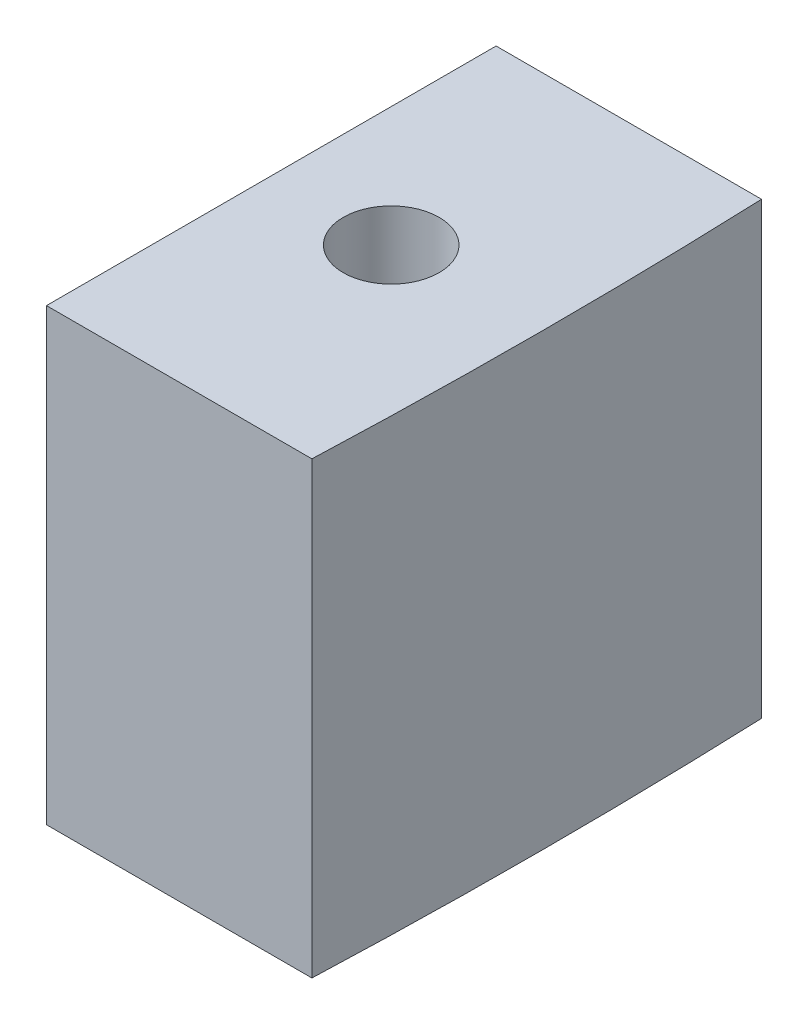
from build123d import *

# Parameters (mm, degrees)
SKETCH_1_W          = 66.89708457
SKETCH_1_H          = 15
EXTRUDE_1_DEPTH     = 15
CUT_EXTRUDE_1_REACH = 39.417
HOLE_WIZARD_M3_1_D  = 3.2
CUT_EXTRUDE_2_DEPTH = 4


with BuildPart() as part:
    # 草图1 → 凸台-拉伸1 (new body)
    with BuildSketch(Plane(origin=(0, 0, 0), x_dir=(1, 0, 0), z_dir=(0, 1, 0))):
        Rectangle(SKETCH_1_W, SKETCH_1_H)
    extrude(amount=EXTRUDE_1_DEPTH)

    # 草图2 → 切除-拉伸1 (cut, up to next)
    with BuildSketch(Plane.XZ, mode=Mode.PRIVATE) as cut_extrude_1_sk1:
        with BuildLine():
            Line((-24.593570721, 7.5), (33.448542285, 7.5))
            Line((33.448542285, 7.5), (33.448542285, -7.5))
            Line((33.448542285, -7.5), (-24.593570721, -7.5))
            ThreePointArc((-24.593570721, -7.5), (-24.448542285, 0), (-24.593570721, 7.5))
        make_face()
    cut_extrude_1_tool1 = extrude(cut_extrude_1_sk1.sketch, amount=-CUT_EXTRUDE_1_REACH, mode=Mode.PRIVATE) & part.part
    add(cut_extrude_1_tool1.solids().sort_by_distance((4.475816, 0, 0))[0], mode=Mode.SUBTRACT)

    # M3 间隙孔1 (through all)
    with Locations(Plane(origin=(0, 0, 0), x_dir=(-1, 0, 0), z_dir=(0, -1, 0))):
        with Locations((29.448542285, 0)):
            Hole(HOLE_WIZARD_M3_1_D / 2)

    # 草图5 → 切除-拉伸2 (cut)
    with BuildSketch(Plane.XZ):
        Polygon((-29.448542285, -3.233161507), (-26.648542285, -1.616580754), (-26.648542285, 1.616580754), (-29.448542285, 3.233161507), (-32.248542285, 1.616580754), (-32.248542285, -1.616580754), align=None)
    extrude(amount=-CUT_EXTRUDE_2_DEPTH, mode=Mode.SUBTRACT)


solid = part.part
